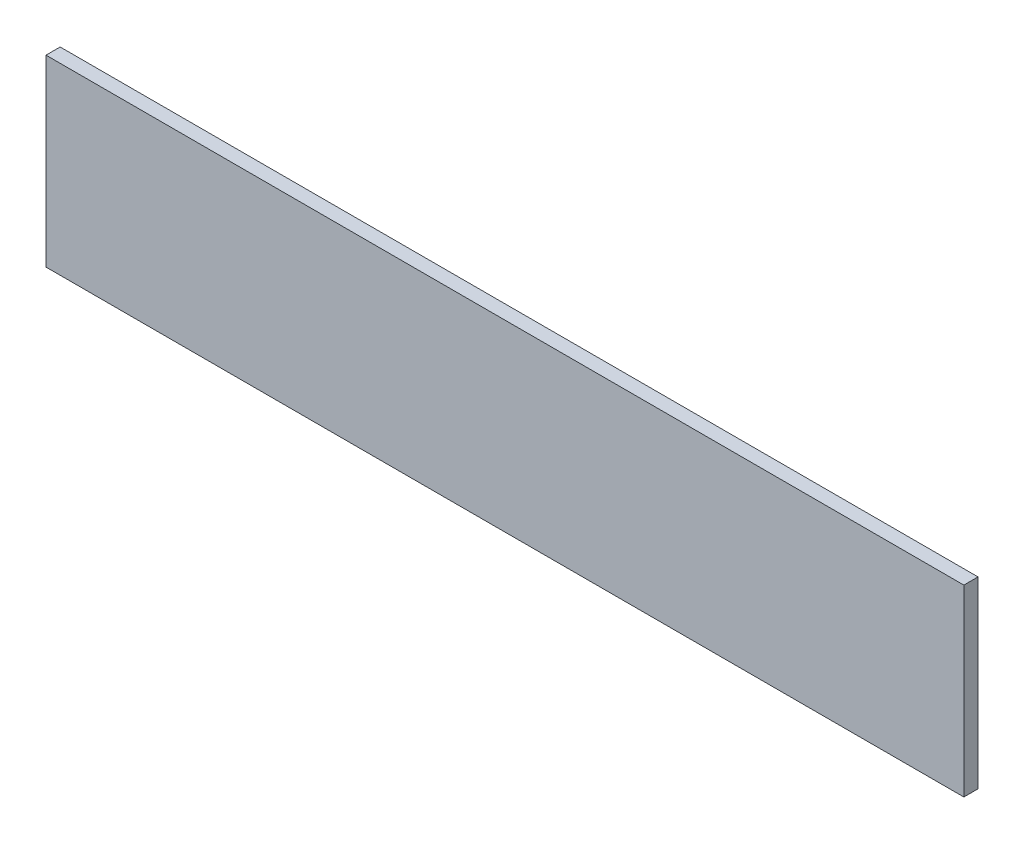
from build123d import *

# Parameters (mm, degrees)
CROQUIS1_W              = 194.571923744
CROQUIS1_H              = 38.914384749
SALIENTE_EXTRUIR1_DEPTH = 3


with BuildPart() as part:
    # Croquis1 → Saliente-Extruir1 (new body)
    with BuildSketch(Plane.XY):
        with Locations((-57.192826577, -2.432149046)):
            Rectangle(CROQUIS1_W, CROQUIS1_H)
    extrude(amount=SALIENTE_EXTRUIR1_DEPTH)


solid = part.part
